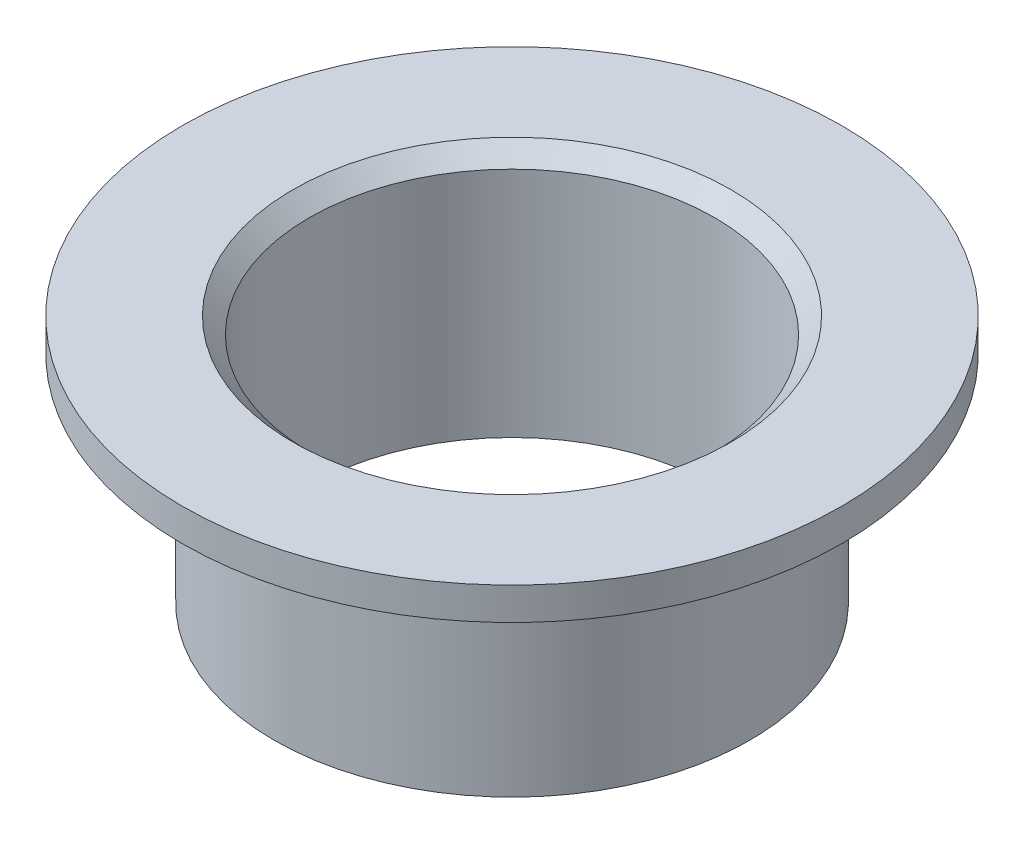
from build123d import *

# Parameters (mm, degrees)
CHAMFER1_SIZE = 3


with BuildPart() as part:
    # Sketch1 → Revolve1 (revolve)
    with BuildSketch(Plane.XY, mode=Mode.PRIVATE) as revolve1_sk:
        Polygon((-44, 0), (-44, 40), (-61, 40), (-61, 46), (-37.5, 46), (-37.5, 0), align=None)
    revolve(revolve1_sk.sketch.rotate(Axis((0, 0, 0), (0, 1, 0)), 270), axis=Axis((0, 0, 0), (0, 1, 0)))

    # Chamfer1
    chamfer1_edges = [part.edges().sort_by_distance(p)[0] for p in [
        (0, 46, 37.5),
    ]]
    chamfer(chamfer1_edges, length=CHAMFER1_SIZE)


solid = part.part
